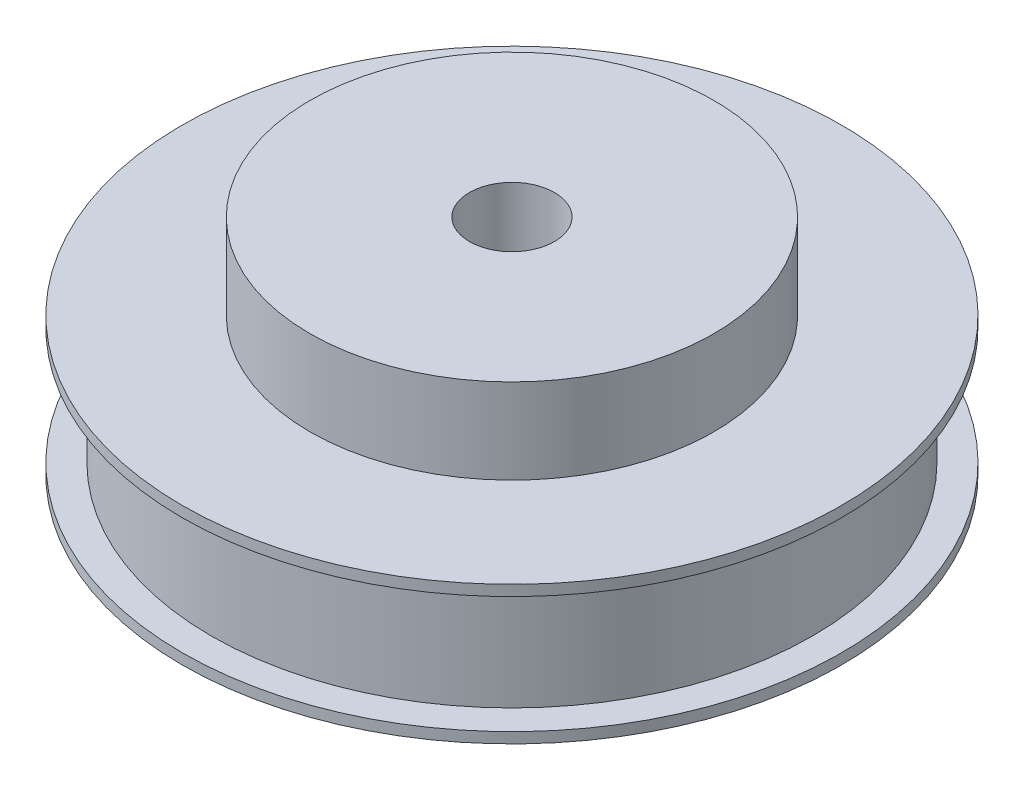
from build123d import *

# Parameters (mm, degrees)
SKETCH_1_R          = 31
EXTRUDE_1_DEPTH     = 1
SKETCH_2_R          = 28.27
EXTRUDE_2_DEPTH     = 11
SKETCH_3_R          = 31
EXTRUDE_3_DEPTH     = 1
SKETCH_4_R          = 19
EXTRUDE_4_DEPTH     = 8
SKETCH_5_R          = 4
CUT_EXTRUDE_1_DEPTH = 49.610698411


with BuildPart() as part:
    # Эскиз1 → Бобышка-Вытянуть1 (new body)
    with BuildSketch(Plane(origin=(0, 0, 0), x_dir=(1, 0, 0), z_dir=(0, 1, 0))):
        with Locations(Location((0, 0, 0), (0, 0, 270))):
            Circle(SKETCH_1_R)
    extrude(amount=EXTRUDE_1_DEPTH)

    # Эскиз2 → Бобышка-Вытянуть2 (add)
    with BuildSketch(Plane(origin=(0, 1, 0), x_dir=(1, 0, 0), z_dir=(0, 1, 0))):
        with Locations(Location((0, 0, 0), (0, 0, 270))):
            Circle(SKETCH_2_R)
    extrude(amount=EXTRUDE_2_DEPTH)

    # Эскиз3 → Бобышка-Вытянуть3 (add)
    with BuildSketch(Plane(origin=(0, 12, 0), x_dir=(1, 0, 0), z_dir=(0, 1, 0))):
        with Locations(Location((0, 0, 0), (0, 0, 270))):
            Circle(SKETCH_3_R)
    extrude(amount=EXTRUDE_3_DEPTH)

    # Эскиз4 → Бобышка-Вытянуть4 (add)
    with BuildSketch(Plane(origin=(0, 13, 0), x_dir=(1, 0, 0), z_dir=(0, 1, 0))):
        with Locations(Location((0, 0, 0), (0, 0, 270))):
            Circle(SKETCH_4_R)
    extrude(amount=EXTRUDE_4_DEPTH)

    # Эскиз5 → Вырез-Вытянуть1 (cut, through all)
    with BuildSketch(Plane(origin=(0, 21, 0), x_dir=(1, 0, 0), z_dir=(0, 1, 0))):
        with Locations(Location((0, 0, 0), (0, 0, 270))):
            Circle(SKETCH_5_R)
    extrude(amount=-CUT_EXTRUDE_1_DEPTH, mode=Mode.SUBTRACT)


solid = part.part
